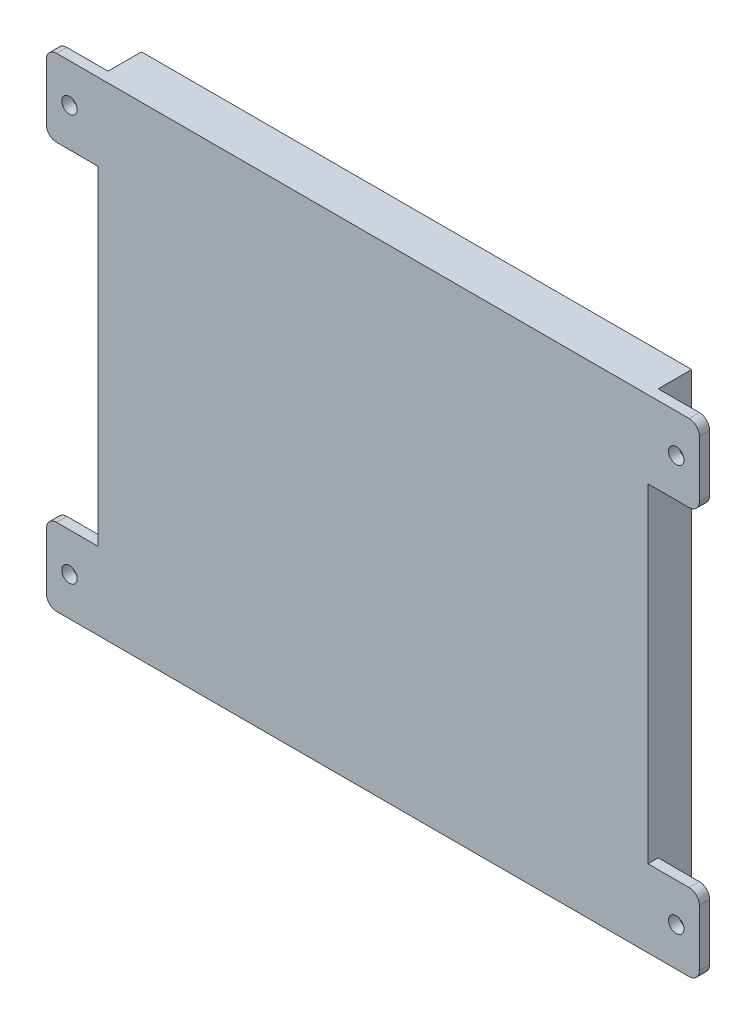
from build123d import *

# Parameters (mm, degrees)
SKETCH_1_W          = 107
SKETCH_1_H          = 94
EXTRUDE_1_DEPTH     = 8.5
SKETCH_2_W          = 104
SKETCH_2_H          = 91
CUT_EXTRUDE_1_DEPTH = 6.5
SKETCH_3_W          = 100
SKETCH_3_H          = 5.5
CUT_EXTRUDE_2_DEPTH = 6
SKETCH_4_W          = 10
SKETCH_4_H          = 15
EXTRUDE_2_DEPTH     = 2
FILLET_1_R          = 2
SKETCH_5_R          = 1.5
CUT_EXTRUDE_3_DEPTH = 3


with BuildPart() as part:
    # 草图1 → 凸台-拉伸1 (new body)
    with BuildSketch(Plane.XY):
        Rectangle(SKETCH_1_W, SKETCH_1_H)
    extrude(amount=EXTRUDE_1_DEPTH)

    # 草图2 → 切除-拉伸1 (cut)
    with BuildSketch(Plane(origin=(0, 0, 0), x_dir=(-1, 0, 0), z_dir=(0, 0, -1))):
        Rectangle(SKETCH_2_W, SKETCH_2_H)
    extrude(amount=-CUT_EXTRUDE_1_DEPTH, mode=Mode.SUBTRACT)

    # 草图3 → 切除-拉伸2 (cut)
    with BuildSketch(Plane.XZ.offset(47)):
        with Locations((0, 0.75)):
            Rectangle(SKETCH_3_W, SKETCH_3_H)
    extrude(amount=-CUT_EXTRUDE_2_DEPTH, mode=Mode.SUBTRACT)

    # 草图4 → 凸台-拉伸2 (add)
    with BuildSketch(Plane.XY.offset(8.5)):
        with Locations((58.5, 39.5)):
            Rectangle(SKETCH_4_W, SKETCH_4_H)
        with Locations((58.5, -39.5)):
            Rectangle(SKETCH_4_W, SKETCH_4_H)
        with Locations((-58.5, 39.5)):
            Rectangle(SKETCH_4_W, SKETCH_4_H)
        with Locations((-58.5, -39.5)):
            Rectangle(SKETCH_4_W, SKETCH_4_H)
    extrude(amount=-EXTRUDE_2_DEPTH)

    # 圆角1
    fillet_1_edges = [part.edges().sort_by_distance(p)[0] for p in [
        (63.5, 47, 7.5),
        (63.5, 32, 7.5),
        (63.5, -47, 7.5),
        (63.5, -32, 7.5),
        (-63.5, 47, 7.5),
        (-63.5, 32, 7.5),
        (-63.5, -47, 7.5),
        (-63.5, -32, 7.5),
    ]]
    fillet(fillet_1_edges, radius=FILLET_1_R)

    # 草图5 → 切除-拉伸3 (cut)
    with BuildSketch(Plane(origin=(0, 0, 6.5), x_dir=(-1, 0, 0), z_dir=(0, 0, -1))):
        with Locations((59, 39.5)):
            Circle(SKETCH_5_R)
        with Locations(Location((59, -39.5, 0), (0, 0, 180))):
            Circle(SKETCH_5_R)
        with Locations(Location((-59, 39.5, 0), (0, 0, 180))):
            Circle(SKETCH_5_R)
        with Locations((-59, -39.5)):
            Circle(SKETCH_5_R)
    extrude(amount=-CUT_EXTRUDE_3_DEPTH, mode=Mode.SUBTRACT)


solid = part.part
